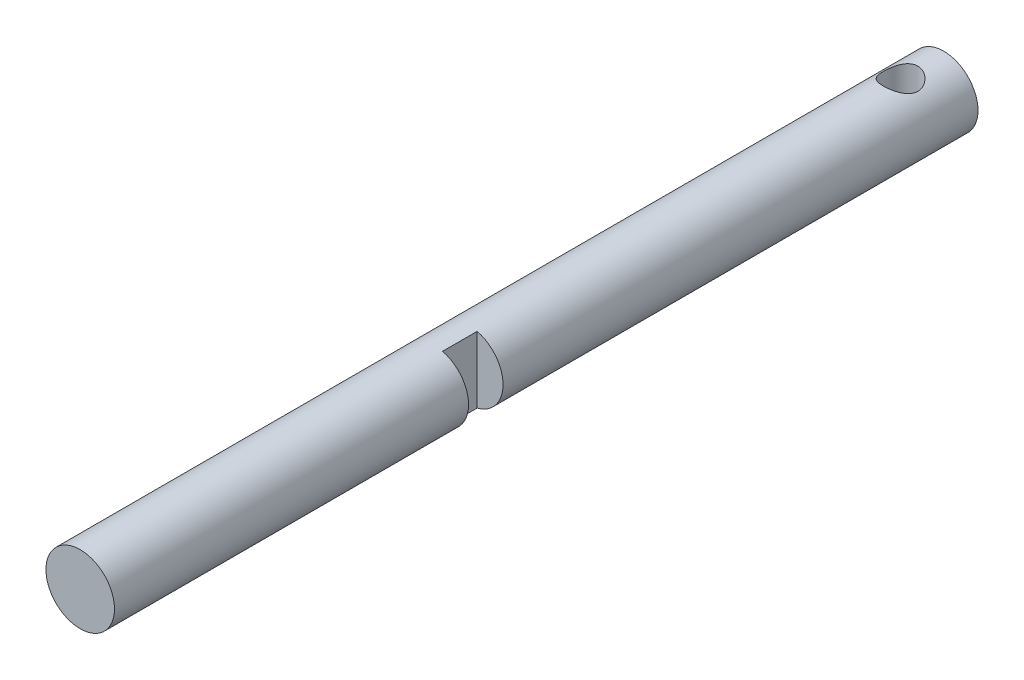
from build123d import *

# Parameters (mm, degrees)
SKETCH1_R               = 3.96875
BOSS_EXTRUDE1_DEPTH     = 100
CUT_EXTRUDE2_DEPTH      = 101.157385914
CUT_EXTRUDE2_DEPTH_BACK = 101.157385914
SKETCH3_R               = 2
CUT_EXTRUDE3_DEPTH      = 101.157386022
CUT_EXTRUDE3_DEPTH_BACK = 101.157386022
SKETCH5_W               = 3
SKETCH5_H               = 4


with BuildPart() as part:
    # Sketch1 → Boss-Extrude1 (new body)
    with BuildSketch(Plane.XY):
        Circle(SKETCH1_R)
    extrude(amount=BOSS_EXTRUDE1_DEPTH)

    # Sketch3 → Cut-Extrude2 (cut, two sides: drawn at the far end of the back side and taken through both)
    with BuildSketch(Plane(origin=(0, 0, 0), x_dir=(1, 0, 0), z_dir=(0, 1, 0)).offset(-CUT_EXTRUDE2_DEPTH_BACK)):
        with Locations((0, -5)):
            Circle(SKETCH3_R)
    extrude(amount=CUT_EXTRUDE2_DEPTH + CUT_EXTRUDE2_DEPTH_BACK, mode=Mode.SUBTRACT)

    # Sketch5 → Cut-Extrude3 (cut, two sides: drawn at the far end of the back side and taken through both)
    with BuildSketch(Plane(origin=(0, 0, 0), x_dir=(1, 0, 0), z_dir=(0, 1, 0)).offset(-CUT_EXTRUDE3_DEPTH_BACK)):
        with Locations((2.46875, -57)):
            Rectangle(SKETCH5_W, SKETCH5_H)
    extrude(amount=CUT_EXTRUDE3_DEPTH + CUT_EXTRUDE3_DEPTH_BACK, mode=Mode.SUBTRACT)


solid = part.part
